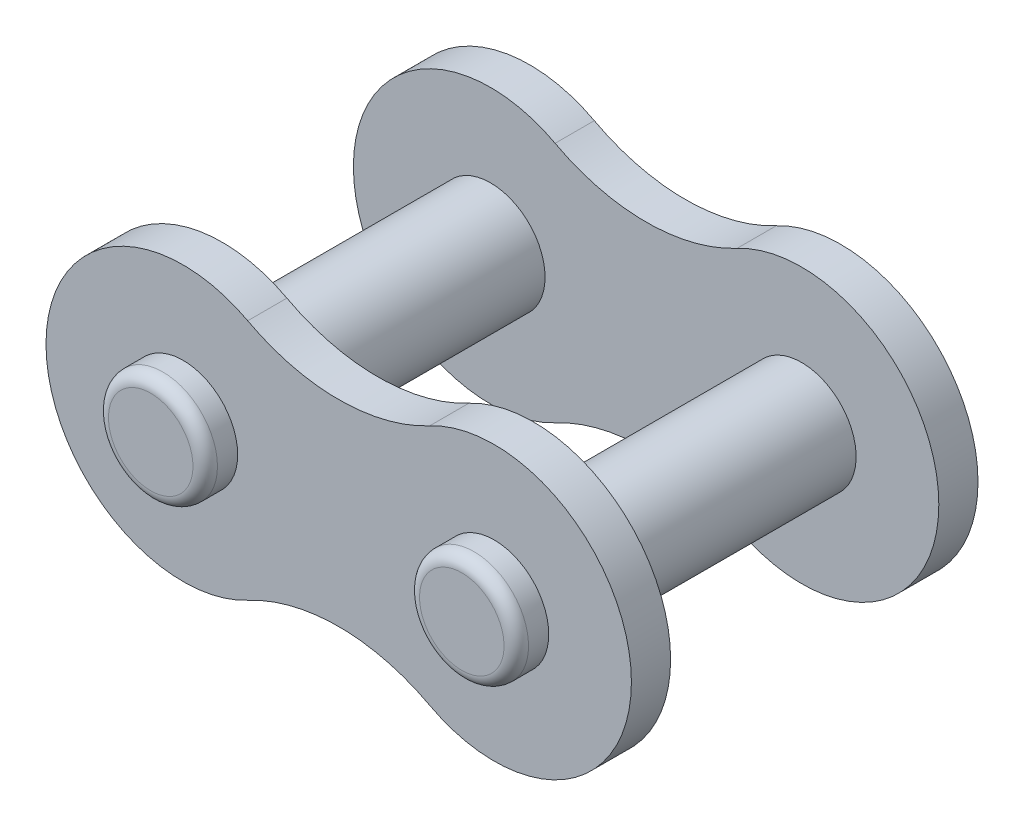
from build123d import *

# Parameters (mm, degrees)
SKETCH3_R           = 2.225
BOSS_EXTRUDE1_DEPTH = 1.6


with BuildPart() as part:
    # Sketch1 → Revolve1 (revolve)
    with BuildSketch(Plane(origin=(0, 0, 0), x_dir=(1, 0, 0), z_dir=(0, 1, 0))):
        with BuildLine():
            Line((0, -8.4), (0, 8.4))
            Line((0, 8.4), (1.725, 8.4))
            ThreePointArc((1.725, 8.4), (2.078553391, 8.253553391), (2.225, 7.9))
            Line((2.225, 7.9), (2.225, -7.9))
            ThreePointArc((2.225, -7.9), (2.078553391, -8.253553391), (1.725, -8.4))
            Line((1.725, -8.4), (0, -8.4))
        make_face()
    revolve(axis=Axis((0, 0, -9.24), (0, 0, 1)))



with BuildPart() as body_2:
    # Sketch2 → Revolve2 (revolve)
    with BuildSketch(Plane.XZ):
        with BuildLine():
            Line((-12.7, 8.4), (-14.425, 8.4))
            ThreePointArc((-14.425, 8.4), (-14.778553391, 8.253553391), (-14.925, 7.9))
            Line((-14.925, 7.9), (-14.925, -7.9))
            ThreePointArc((-14.925, -7.9), (-14.778553391, -8.253553391), (-14.425, -8.4))
            Line((-14.425, -8.4), (-12.7, -8.4))
            Line((-12.7, -8.4), (-12.7, 8.4))
        make_face()
    revolve(axis=Axis((-12.7, 0, 8.4), (0, 0, -1)))


with BuildPart() as part_1:
    add(part.part)

    add(body_2.part)  # Boss-Extrude1 merges body 2
    # Sketch3 → Boss-Extrude1 (add)
    with BuildSketch(Plane(origin=(0, 0, -5.475), x_dir=(0, -1, 0), z_dir=(0, 0, -1))):
        with BuildLine():
            ThreePointArc((-4.941202509, 2.635245294), (0, -5.6), (4.941202509, 2.635245294))
            ThreePointArc((4.941202509, 2.635245294), (4.012533333, 6.35), (4.941202509, 10.064754706))
            ThreePointArc((4.941202509, 10.064754706), (0, 18.3), (-4.941202509, 10.064754706))
            ThreePointArc((-4.941202509, 10.064754706), (-4.012533333, 6.35), (-4.941202509, 2.635245294))
        make_face()
        Circle(SKETCH3_R, mode=Mode.SUBTRACT)
        with Locations((0, 12.7)):
            Circle(SKETCH3_R, mode=Mode.SUBTRACT)
    boss_extrude1 = extrude(amount=BOSS_EXTRUDE1_DEPTH)

    # Mirror1: Boss-Extrude1 across plane
    add(boss_extrude1.mirror(Plane.XY))


solid = part_1.part
